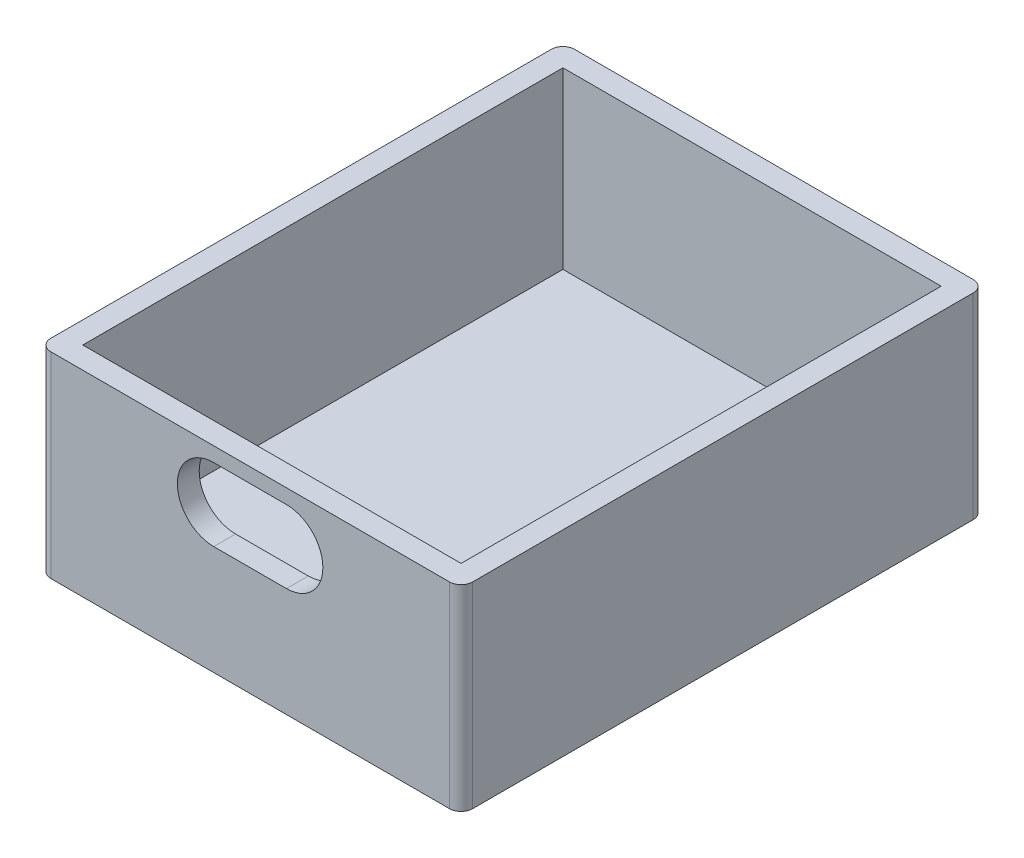
from build123d import *

# Parameters (mm, degrees)
SKETCH1_W           = 29
SKETCH1_H           = 13.5
BOSS_EXTRUDE1_DEPTH = 36
SKETCH2_W           = 26
SKETCH2_H           = 33
CUT_EXTRUDE1_DEPTH  = 12
CUT_EXTRUDE2_DEPTH  = 1.5
FILLET1_R           = 0.8
SKETCH5_W           = 4
SKETCH5_H           = 8
BOSS_EXTRUDE2_DEPTH = 3.5
CUT_EXTRUDE3_REACH  = 49.011
SKETCH6_W           = 5
SKETCH6_H           = 1.5


with BuildPart() as part:
    # Sketch1 → Boss-Extrude1 (new body)
    with BuildSketch(Plane.XY):
        with Locations((14.5, -6.75)):
            Rectangle(SKETCH1_W, SKETCH1_H)
    extrude(amount=BOSS_EXTRUDE1_DEPTH)

    # Sketch2 → Cut-Extrude1 (cut)
    with BuildSketch(Plane(origin=(0, 0, 0), x_dir=(1, 0, 0), z_dir=(0, 1, 0))):
        with Locations((14.5, -18)):
            Rectangle(SKETCH2_W, SKETCH2_H)
    extrude(amount=-CUT_EXTRUDE1_DEPTH, mode=Mode.SUBTRACT)

    # Sketch3 → Cut-Extrude2 (cut)
    with BuildSketch(Plane.XY.offset(36)):
        with BuildLine():
            Line((12, -1), (17, -1))
            ThreePointArc((17, -1), (19.5, -3.5), (17, -6))
            Line((17, -6), (12, -6))
            ThreePointArc((12, -6), (9.5, -3.5), (12, -1))
        make_face()
    extrude(amount=-CUT_EXTRUDE2_DEPTH, mode=Mode.SUBTRACT)

    # Fillet1
    fillet1_edges = [part.edges().sort_by_distance(p)[0] for p in [
        (29, -6.75, 36),
        (0, -6.75, 36),
        (29, -6.75, 0),
        (0, -6.75, 0),
    ]]
    fillet(fillet1_edges, radius=FILLET1_R)

    # Sketch5 → Boss-Extrude2 (add)
    with BuildSketch(Plane.XZ.offset(13.5)):
        with Locations((20, 14)):
            Rectangle(SKETCH5_W, SKETCH5_H)
        with Locations((6, 14)):
            Rectangle(SKETCH5_W, SKETCH5_H)
    extrude(amount=BOSS_EXTRUDE2_DEPTH)

    # Cut-Extrude3: up to this face of the body (flat: up to its plane)
    cut_extrude3_end = Plane(part.part.faces().sort_by_distance((22, -15.25, 14))[0])
    # Sketch6 → Cut-Extrude3 (cut, up to the picked face)
    with BuildSketch(Plane.ZY.offset(-4), mode=Mode.PRIVATE) as cut_extrude3_sk1:
        with Locations((15.5, -14.25)):
            Rectangle(SKETCH6_W, SKETCH6_H)
    cut_extrude3_tool1 = split(extrude(cut_extrude3_sk1.sketch, amount=-CUT_EXTRUDE3_REACH, mode=Mode.PRIVATE), bisect_by=cut_extrude3_end, keep=Keep.BOTH, mode=Mode.PRIVATE)
    add(cut_extrude3_tool1.solids().sort_by(Axis((4, -14.25, 15.5), (1, 0, 0)))[0], mode=Mode.SUBTRACT)


solid = part.part
